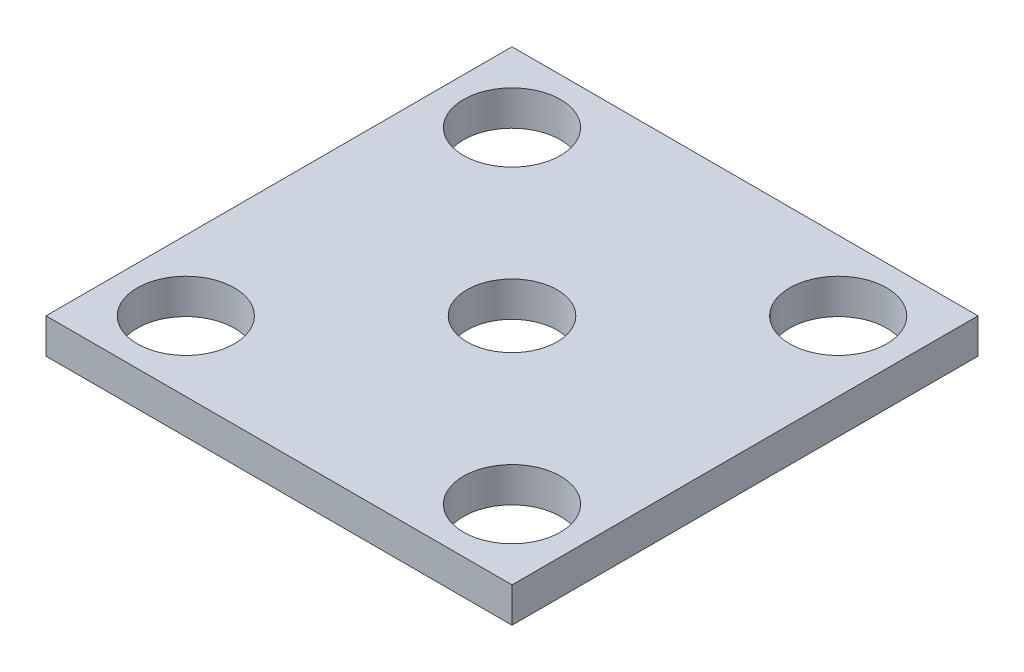
from build123d import *

# Parameters (mm, degrees)
SKETCH1_W           = 40
SKETCH1_H           = 40
SKETCH1_R           = 3.875
SKETCH1_R_2         = 4.1656
BOSS_EXTRUDE1_DEPTH = 3


with BuildPart() as part:
    # Sketch1 → Boss-Extrude1 (new body)
    with BuildSketch(Plane(origin=(0, 0, 0), x_dir=(1, 0, 0), z_dir=(0, 1, 0))):
        with Locations((20, 20)):
            Rectangle(SKETCH1_W, SKETCH1_H)
        with Locations(Location((20, 20, 0), (0, 0, 270))):
            Circle(SKETCH1_R, mode=Mode.SUBTRACT)
        with Locations(Location((6, 34, 0), (0, 0, 270))):
            Circle(SKETCH1_R_2, mode=Mode.SUBTRACT)
        with Locations(Location((6, 6, 0), (0, 0, 270))):
            Circle(SKETCH1_R_2, mode=Mode.SUBTRACT)
        with Locations(Location((34, 6, 0), (0, 0, 270))):
            Circle(SKETCH1_R_2, mode=Mode.SUBTRACT)
        with Locations(Location((34, 34, 0), (0, 0, 270))):
            Circle(SKETCH1_R_2, mode=Mode.SUBTRACT)
    extrude(amount=BOSS_EXTRUDE1_DEPTH)


solid = part.part
